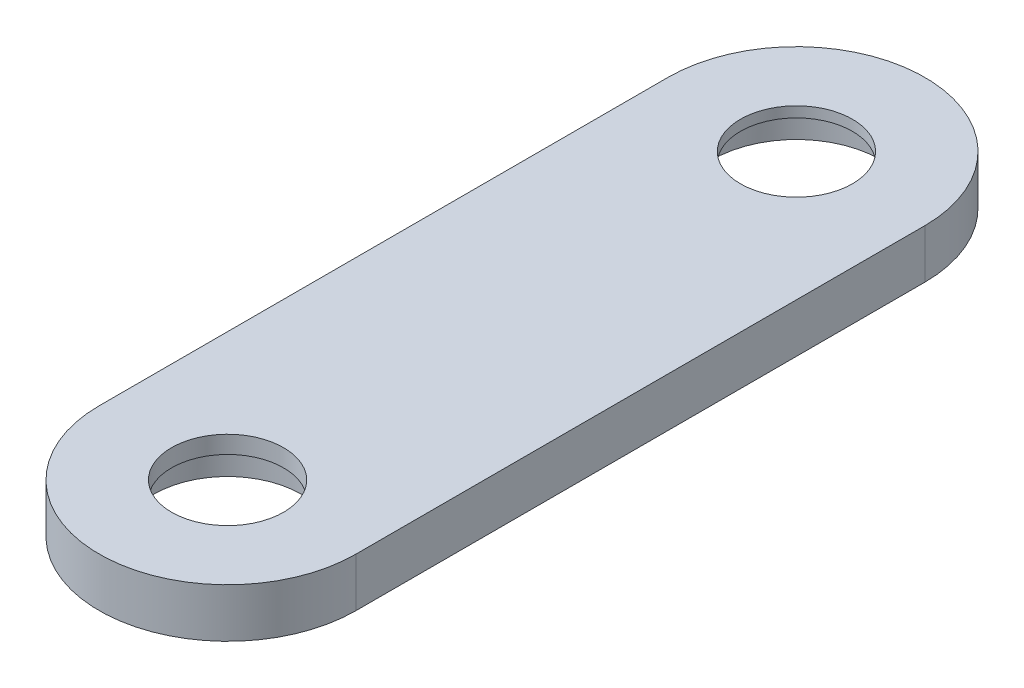
from build123d import *

# Parameters (mm, degrees)
SKETCH1_R           = 12.000000003
BOSS_EXTRUDE1_DEPTH = 13
SKETCH2_R           = 12.000000003
CUT_EXTRUDE1_DEPTH  = 6
BOSS_EXTRUDE2_START = -1.5
SKETCH3_R           = 12.000000003
SKETCH3_R_2         = 8
BOSS_EXTRUDE2_DEPTH = 1.5
SKETCH4_W           = 40.64
SKETCH4_H           = 6
CUT_EXTRUDE2_DEPTH  = 107.967410462
BOSS_EXTRUDE3_START = 5.499999908
SKETCH6_R           = 12.000000003
SKETCH6_R_2         = 10.5
BOSS_EXTRUDE3_DEPTH = 5.499999908
MOVE_FACE3_BY       = 1.000000032


with BuildPart() as part:
    # Sketch1 → Boss-Extrude1 (new body)
    with BuildSketch(Plane(origin=(0, 0, 0), x_dir=(1, 0, 0), z_dir=(0, 1, 0))):
        with BuildLine():
            Line((-18.350000003, 0), (-18.350000003, 81.28))
            ThreePointArc((-18.350000003, 81.28), (0, 99.630000003), (18.350000003, 81.28))
            Line((18.350000003, 81.28), (18.350000003, 0))
            ThreePointArc((18.350000003, 0), (0, -18.350000003), (-18.350000003, 0))
        make_face()
        with Locations(Location((0, 0, 0), (0, 0, 270))):
            Circle(SKETCH1_R, mode=Mode.SUBTRACT)
        with Locations(Location((0, 81.28, 0), (0, 0, 270))):
            Circle(SKETCH1_R, mode=Mode.SUBTRACT)
    extrude(amount=BOSS_EXTRUDE1_DEPTH)

    # Sketch2 → Cut-Extrude1 (cut)
    # profile 1 of 2: a face of its own
    with BuildSketch(Plane.XZ):
        with BuildLine():
            Line((-18.350000003, -60.96), (-18.350000003, -81.28))
            ThreePointArc((-18.350000003, -81.28), (0, -99.630000003), (18.350000003, -81.28))
            Line((18.350000003, -81.28), (18.350000003, -60.96))
            Line((18.350000003, -60.96), (-18.350000003, -60.96))
        make_face()
        with Locations(Location((0, -81.28, 0), (0, 0, 270))):
            Circle(SKETCH2_R, mode=Mode.SUBTRACT)
    # profile 2 of 2: a face of its own
    with BuildSketch(Plane.XZ):
        with BuildLine():
            ThreePointArc((18.350000003, 0), (0, 18.350000003), (-18.350000003, 0))
            Line((-18.350000003, 0), (-18.350000003, -20.32))
            Line((-18.350000003, -20.32), (18.350000003, -20.32))
            Line((18.350000003, -20.32), (18.350000003, 0))
        make_face()
    extrude(amount=-CUT_EXTRUDE1_DEPTH, mode=Mode.SUBTRACT)

    # Sketch3 → Boss-Extrude2 (add)
    # profile 1 of 2: a face of its own
    with BuildSketch(Plane(origin=(0, 12.999999908, 0), x_dir=(1, 0, 0), z_dir=(0, 1, 0)).offset(BOSS_EXTRUDE2_START)):
        with Locations(Location((0, 81.28, 0), (0, 0, 90))):
            Circle(SKETCH3_R)
        with Locations(Location((0, 81.28, 0), (0, 0, 270))):
            Circle(SKETCH3_R_2, mode=Mode.SUBTRACT)
    # profile 2 of 2: a face of its own
    with BuildSketch(Plane(origin=(0, 12.999999908, 0), x_dir=(1, 0, 0), z_dir=(0, 1, 0)).offset(BOSS_EXTRUDE2_START)):
        with Locations(Location((0, 0, 0), (0, 0, 90))):
            Circle(SKETCH3_R)
        with Locations(Location((0, 0, 0), (0, 0, 270))):
            Circle(SKETCH3_R_2, mode=Mode.SUBTRACT)
    extrude(amount=BOSS_EXTRUDE2_DEPTH)

    # Sketch4 → Cut-Extrude2 (cut, through all)
    with BuildSketch(Plane.ZY.offset(18.350000003)):
        with Locations((-40.64, 3)):
            Rectangle(SKETCH4_W, SKETCH4_H)
    extrude(amount=-CUT_EXTRUDE2_DEPTH, mode=Mode.SUBTRACT)

    # Sketch6 → Boss-Extrude3 (add)
    with BuildSketch(Plane.XZ.offset(-11.499999908).offset(BOSS_EXTRUDE3_START)):
        Circle(SKETCH6_R)
        with Locations(Location((0, 0, 0), (0, 0, 270))):
            Circle(SKETCH6_R_2, mode=Mode.SUBTRACT)
    extrude(amount=-BOSS_EXTRUDE3_DEPTH)

    # Move Face3: a face moved outward by 1.0
    extrude(part.faces().sort_by_distance((0, 11.499999908, 8.4))[0], amount=MOVE_FACE3_BY, dir=(0, -1, 0))


solid = part.part
